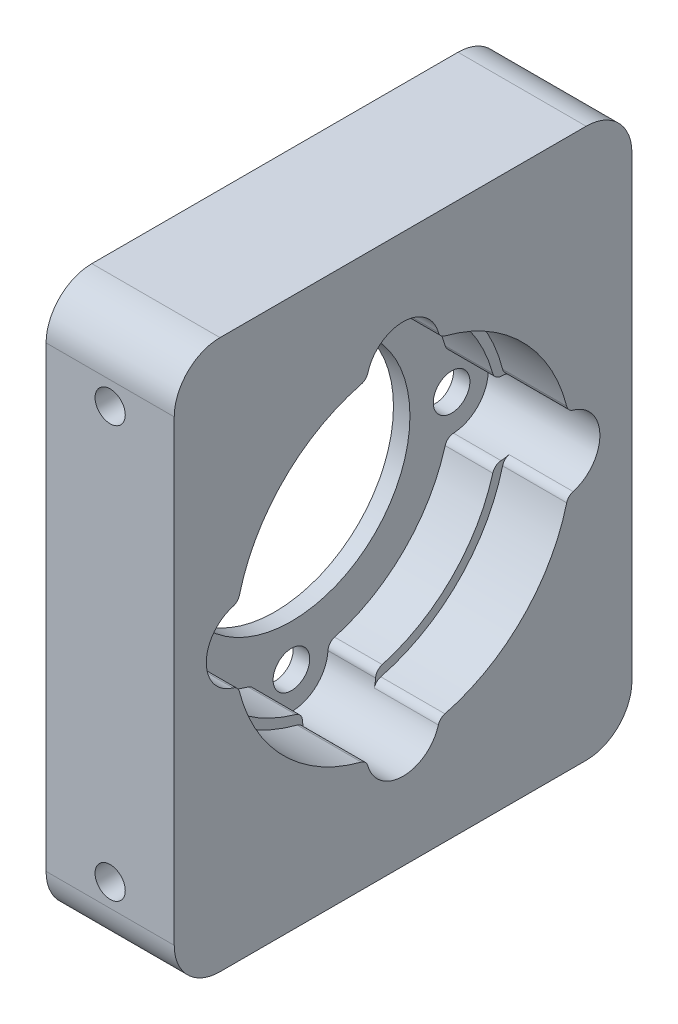
from build123d import *

# Parameters (mm, degrees)
SKETCH_1_R               = 25
SKETCH_1_W               = 50
SKETCH_1_H               = 30
EXTRUDE_1_DEPTH          = 15
SKETCH_2_R               = 12.95
CUT_EXTRUDE_1_DEPTH      = 42.833001327
SKETCH_3_R               = 18.45
CUT_EXTRUDE_2_DEPTH      = 8
SKETCH_4_R               = 17.45
CUT_EXTRUDE_3_DEPTH      = 5.2
CUT_EXTRUDE_4_DEPTH      = 42.221838872
CUT_EXTRUDE_4_DEPTH_BACK = 42.221838872
SKETCH_5_R               = 2
SKETCH_6_R               = 4
CUT_EXTRUDE_5_DEPTH      = 13.2
CUT_EXTRUDE_START        = -1
CUT_EXTRUDE_7_DEPTH      = 1
EXTRUDE_2_DEPTH          = 14
SKETCH_13_R              = 1.65
CUT_EXTRUDE_11_DEPTH     = 10
FILLET_1_R               = 5
FILLET_2_R               = 1


with BuildPart() as part:
    # ｽｹｯﾁ1 → ﾎﾞｽ - 押し出し1 (new body)
    with BuildSketch(Plane(origin=(0, 0, 0), x_dir=(0, 0, -1), z_dir=(1, 0, 0))):
        Circle(SKETCH_1_R)
        with Locations((0, 15)):
            Rectangle(SKETCH_1_W, SKETCH_1_H)
        with BuildLine():
            ThreePointArc((25, 0), (0, 25), (-25, 0))
            Line((-25, 0), (25, 0))
        make_face()
        with BuildLine():
            Line((25, 0), (-25, 0))
            ThreePointArc((-25, 0), (0, -25), (25, 0))
        make_face()
        with BuildLine():
            ThreePointArc((25, 0), (0, 25), (-25, 0))
            Line((-25, 0), (25, 0))
        make_face()
        with BuildLine():
            Line((25, 0), (-25, 0))
            ThreePointArc((-25, 0), (0, -25), (25, 0))
        make_face()
    extrude(amount=EXTRUDE_1_DEPTH)

    # ｽｹｯﾁ2 → ｶｯﾄ - 押し出し1 (cut, through all)
    with BuildSketch(Plane(origin=(15, 0, 0), x_dir=(0, 0, -1), z_dir=(1, 0, 0))):
        Circle(SKETCH_2_R)
    extrude(amount=-CUT_EXTRUDE_1_DEPTH, mode=Mode.SUBTRACT)

    # ｽｹｯﾁ3 → ｶｯﾄ - 押し出し2 (cut)
    with BuildSketch(Plane(origin=(15, 0, 0), x_dir=(0, 0, -1), z_dir=(1, 0, 0))):
        Circle(SKETCH_3_R)
    extrude(amount=-CUT_EXTRUDE_2_DEPTH, mode=Mode.SUBTRACT)

    # ｽｹｯﾁ4 → ｶｯﾄ - 押し出し3 (cut)
    with BuildSketch(Plane(origin=(7, 0, 0), x_dir=(0, 0, -1), z_dir=(1, 0, 0))):
        Circle(SKETCH_4_R)
    extrude(amount=-CUT_EXTRUDE_3_DEPTH, mode=Mode.SUBTRACT)

    # ｽｹｯﾁ5 → ｶｯﾄ - 押し出し4 (cut, two sides: drawn at the far end of the back side and taken through both)
    with BuildSketch(Plane(origin=(1.8, 0, 0), x_dir=(0, 0, -1), z_dir=(1, 0, 0)).offset(-CUT_EXTRUDE_4_DEPTH_BACK)):
        with Locations((0, 17.5)):
            Circle(SKETCH_5_R)
        with Locations((17.5, 0)):
            Circle(SKETCH_5_R)
        with Locations((0, -17.5)):
            Circle(SKETCH_5_R)
        with Locations((-17.5, 0)):
            Circle(SKETCH_5_R)
    extrude(amount=CUT_EXTRUDE_4_DEPTH + CUT_EXTRUDE_4_DEPTH_BACK, mode=Mode.SUBTRACT)

    # ｽｹｯﾁ6 → ｶｯﾄ - 押し出し5 (cut)
    with BuildSketch(Plane(origin=(15, 0, 0), x_dir=(0, 0, -1), z_dir=(1, 0, 0))):
        with Locations((0, 17.5)):
            Circle(SKETCH_6_R)
        with Locations((17.5, 0)):
            Circle(SKETCH_6_R)
        with Locations((0, -17.5)):
            Circle(SKETCH_6_R)
        with Locations((-17.5, 0)):
            Circle(SKETCH_6_R)
    extrude(amount=-CUT_EXTRUDE_5_DEPTH, mode=Mode.SUBTRACT)

    # ｽｹｯﾁ8 → ｶｯﾄ - 押し出し7 (cut)
    with BuildSketch(Plane(origin=(15, 0, 0), x_dir=(0, 0, -1), z_dir=(1, 0, 0)).offset(CUT_EXTRUDE_START)):
        with BuildLine():
            Line((25, 0), (25, 30))
            Line((25, 30), (-25, 30))
            Line((-25, 30), (-25, 0))
            ThreePointArc((-25, 0), (0, -25), (25, 0))
        make_face()
    extrude(amount=CUT_EXTRUDE_7_DEPTH, mode=Mode.SUBTRACT)

    # ｽｹｯﾁ12 → ﾎﾞｽ - 押し出し2 (add)
    with BuildSketch(Plane.ZY):
        with BuildLine():
            Line((25, 0), (25, -30))
            Line((25, -30), (-25, -30))
            Line((-25, -30), (-25, 0))
            ThreePointArc((-25, 0), (0, -25), (25, 0))
        make_face()
    extrude(amount=-EXTRUDE_2_DEPTH)

    # ｽｹｯﾁ13 → ｶｯﾄ - 押し出し11 (cut)
    with BuildSketch(Plane.XY.offset(25)):
        with Locations((7, -22.5)):
            Circle(SKETCH_13_R)
        with Locations((7, 22.5)):
            Circle(SKETCH_13_R)
    cut_extrude_11 = extrude(amount=-CUT_EXTRUDE_11_DEPTH, mode=Mode.SUBTRACT)

    # ﾐﾗｰ4: ｶｯﾄ - 押し出し11 across plane
    add(cut_extrude_11.mirror(Plane.XY), mode=Mode.SUBTRACT)

    # ﾌｨﾚｯﾄ1
    fillet_1_edges = [part.edges().sort_by_distance(p)[0] for p in [
        (7, 30, 25),
        (7, 30, -25),
        (7, -30, 25),
        (7, -30, -25),
    ]]
    fillet(fillet_1_edges, radius=FILLET_1_R)

    # ﾌｨﾚｯﾄ2
    fillet_2_edges = [part.edges().sort_by_distance(p)[0] for p in [
        (4.4, -3.967729649, 16.992928571),
        (10.5, -3.966233678, 18.018642857),
        (4.4, 3.967729649, 16.992928571),
        (10.5, -18.018642857, -3.966233678),
        (4.4, -16.992928571, -3.967729649),
        (4.4, -16.992928571, 3.967729649),
        (10.5, 3.966233678, -18.018642857),
        (4.4, 3.967729649, -16.992928571),
        (4.4, -3.967729649, -16.992928571),
        (10.5, 18.018642857, 3.966233678),
        (4.4, 16.992928571, 3.967729649),
        (4.4, 16.992928571, -3.967729649),
        (10.5, 3.966233678, 18.018642857),
        (10.5, -18.018642857, 3.966233678),
        (10.5, -3.966233678, -18.018642857),
        (10.5, 18.018642857, -3.966233678),
    ]]
    fillet(fillet_2_edges, radius=FILLET_2_R)


solid = part.part
